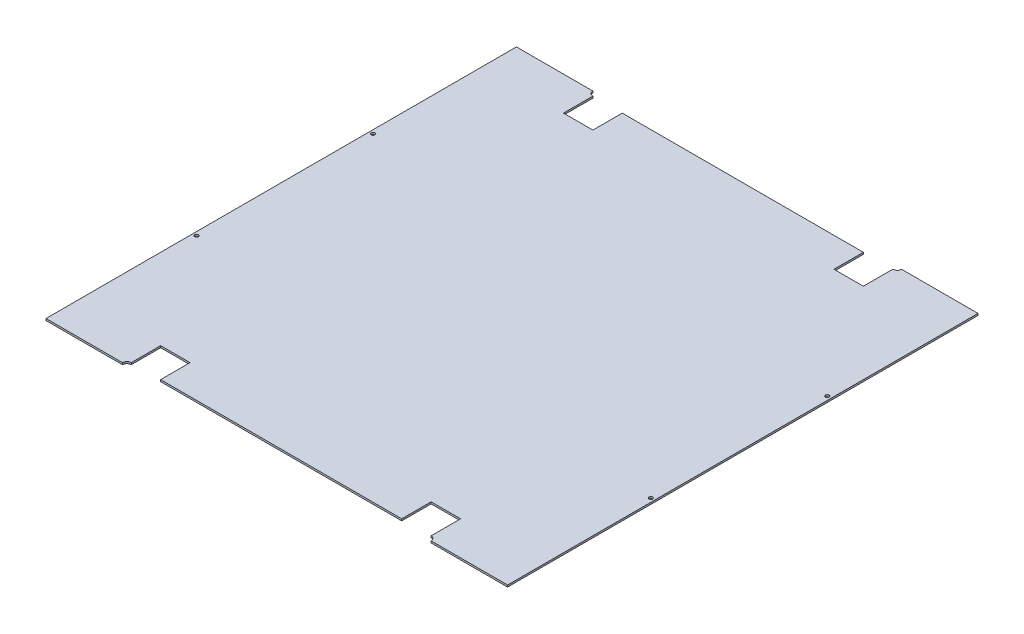
from build123d import *

# Parameters (mm, degrees)
BOSS_EXTRUDE1_DEPTH          = 1.5875
F_1_8_0_125_DIAMETER_HOLE1_D = 3.175


with BuildPart() as part:
    # Sketch1 → Boss-Extrude1 (new body)
    with BuildSketch(Plane(origin=(0, 0, 0), x_dir=(1, 0, 0), z_dir=(0, 1, 0))):
        with BuildLine():
            ThreePointArc((-132.542154043, 202.449520044), (-135.236230879, 203.565443208), (-136.352154043, 206.259520044))
            Line((-136.352154043, 206.259520044), (-202.392154043, 206.259520044))
            Line((-202.392154043, 206.259520044), (-202.392154043, -200.140479956))
            Line((-202.392154043, -200.140479956), (-136.352154043, -200.140479956))
            ThreePointArc((-136.352154043, -200.140479956), (-135.236230879, -197.44640312), (-132.542154043, -196.330479956))
            Line((-132.542154043, -196.330479956), (-132.542154043, -170.930479956))
            Line((-132.542154043, -170.930479956), (-107.142154043, -170.930479956))
            Line((-107.142154043, -170.930479956), (-107.142154043, -196.330479956))
            Line((-107.142154043, -196.330479956), (101.137845957, -196.330479956))
            Line((101.137845957, -196.330479956), (101.137845957, -170.930479956))
            Line((101.137845957, -170.930479956), (126.537845957, -170.930479956))
            Line((126.537845957, -170.930479956), (126.537845957, -196.330479956))
            ThreePointArc((126.537845957, -196.330479956), (129.231922793, -197.44640312), (130.347845957, -200.140479956))
            Line((130.347845957, -200.140479956), (196.387845957, -200.140479956))
            Line((196.387845957, -200.140479956), (196.387845957, 206.259520044))
            Line((196.387845957, 206.259520044), (130.347845957, 206.259520044))
            ThreePointArc((130.347845957, 206.259520044), (129.231922793, 203.565443208), (126.537845957, 202.449520044))
            Line((126.537845957, 202.449520044), (126.537845957, 177.049520044))
            Line((126.537845957, 177.049520044), (101.137845957, 177.049520044))
            Line((101.137845957, 177.049520044), (101.137845957, 202.449520044))
            Line((101.137845957, 202.449520044), (-107.142154043, 202.449520044))
            Line((-107.142154043, 202.449520044), (-107.142154043, 177.049520044))
            Line((-107.142154043, 177.049520044), (-132.542154043, 177.049520044))
            Line((-132.542154043, 177.049520044), (-132.542154043, 202.449520044))
        make_face()
    extrude(amount=BOSS_EXTRUDE1_DEPTH)

    # 1/8 (0.125) Diameter Hole1 (through all)
    with Locations(Plane(origin=(0, 1.5875, 0), x_dir=(1, 0, 0), z_dir=(0, 1, 0))):
        with Locations((-199.217154043, 79.259520044), (-199.217154043, -73.140479956), (193.212845957, -73.140479956), (193.212845957, 79.259520044)):
            Hole(F_1_8_0_125_DIAMETER_HOLE1_D / 2)


solid = part.part
